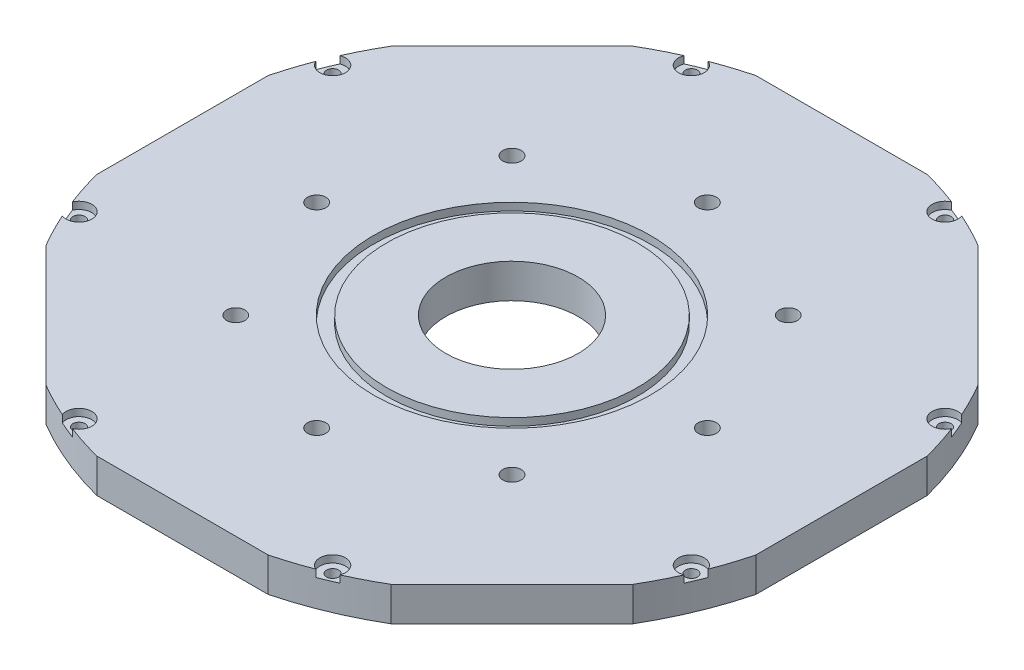
from build123d import *

# Parameters (mm, degrees)
BOSS_EXTRUDE1_DEPTH                                 = 12.7
SKETCH3_R                                           = 24.5745
CUT_EXTRUDE1_DEPTH                                  = 174.423960282
SKETCH5_R                                           = 51.3715
SKETCH5_R_2                                         = 46.5455
CUT_EXTRUDE2_DEPTH                                  = 2.794
CIRPATTERN4_COUNT                                   = 8
CBORE_FOR_8_BINDING_HEAD_MACHINE_SCREW2_D           = 4.4958
CBORE_FOR_8_BINDING_HEAD_MACHINE_SCREW2_CBORE_D     = 9.525
CBORE_FOR_8_BINDING_HEAD_MACHINE_SCREW2_CBORE_DEPTH = 2.667
CIRPATTERN5_COUNT                                   = 8


with BuildPart() as part:
    # Sketch1 → Boss-Extrude1 (new body)
    with BuildSketch(Plane(origin=(0, 0, 0), x_dir=(1, 0, 0), z_dir=(0, 1, 0))):
        with BuildLine():
            ThreePointArc((-31.793446259, 122.3), (-48.357791931, 116.746037126), (-63.997797892, 108.960520786))
            Line((-63.997797892, 108.960520786), (-108.960520786, 63.997797892))
            ThreePointArc((-108.960520786, 63.997797892), (-116.746037126, 48.357791931), (-122.3, 31.793446259))
            Line((-122.3, 31.793446259), (-122.3, -31.793446259))
            ThreePointArc((-122.3, -31.793446259), (-116.746037126, -48.357791931), (-108.960520786, -63.997797892))
            Line((-108.960520786, -63.997797892), (-63.997797892, -108.960520786))
            ThreePointArc((-63.997797892, -108.960520786), (-48.357791931, -116.746037126), (-31.793446259, -122.3))
            Line((-31.793446259, -122.3), (31.793446259, -122.3))
            ThreePointArc((31.793446259, -122.3), (48.357791931, -116.746037126), (63.997797892, -108.960520786))
            Line((63.997797892, -108.960520786), (108.960520786, -63.997797892))
            ThreePointArc((108.960520786, -63.997797892), (116.746037126, -48.357791931), (122.3, -31.793446259))
            Line((122.3, -31.793446259), (122.3, 31.793446259))
            ThreePointArc((122.3, 31.793446259), (116.746037126, 48.357791931), (108.960520786, 63.997797892))
            Line((108.960520786, 63.997797892), (63.997797892, 108.960520786))
            ThreePointArc((63.997797892, 108.960520786), (48.357791931, 116.746037126), (31.793446259, 122.3))
            Line((31.793446259, 122.3), (-31.793446259, 122.3))
        make_face()
    extrude(amount=BOSS_EXTRUDE1_DEPTH)

    # Sketch3 → Cut-Extrude1 (cut, through all)
    with BuildSketch(Plane(origin=(0, 12.7, 0), x_dir=(1, 0, 0), z_dir=(0, 1, 0))):
        with Locations(Location((0, 0, 0), (0, 0, 270))):
            Circle(SKETCH3_R)
    extrude(amount=-CUT_EXTRUDE1_DEPTH, mode=Mode.SUBTRACT)

    # Sketch5 → Cut-Extrude2 (cut)
    with BuildSketch(Plane(origin=(0, 12.7, 0), x_dir=(1, 0, 0), z_dir=(0, 1, 0))):
        with Locations(Location((0, 0, 0), (0, 0, 270))):
            Circle(SKETCH5_R)
        with Locations(Location((0, 0, 0), (0, 0, 270))):
            Circle(SKETCH5_R_2, mode=Mode.SUBTRACT)
    extrude(amount=-CUT_EXTRUDE2_DEPTH, mode=Mode.SUBTRACT)

    # Sketch23 → M8x1.25 Tapped Hole1 (revolve, cut)
    with BuildSketch(Plane(origin=(-72.5, 12.7, 0), x_dir=(0, 0, 1), z_dir=(1, 0, 0))):
        Polygon((0, 0), (0, 8.392926105), (3.4, 6.35), (3.4, 0), align=None)
    m8x1_25_tapped_hole1 = revolve(axis=Axis((-72.5, 19.05, 0), (0, -1, 0)), mode=Mode.SUBTRACT)

    # CirPattern4: M8x1.25 Tapped Hole1 ×8 about axis
    cirpattern4_axis = Axis((0, 0, 0), (0, 1, 0))
    for i in range(1, CIRPATTERN4_COUNT):
        add(m8x1_25_tapped_hole1.rotate(cirpattern4_axis, i * 360 / CIRPATTERN4_COUNT), mode=Mode.SUBTRACT)

    # CBORE for #8 Binding Head Machine Screw2 (through all)
    with Locations(Plane(origin=(0, 12.7, 0), x_dir=(1, 0, 0), z_dir=(0, 1, 0))):
        with Locations((-47.069870839, 113.636720559)):
            cbore_for_8_binding_head_machine_screw2 = CounterBoreHole(CBORE_FOR_8_BINDING_HEAD_MACHINE_SCREW2_D / 2, CBORE_FOR_8_BINDING_HEAD_MACHINE_SCREW2_CBORE_D / 2, CBORE_FOR_8_BINDING_HEAD_MACHINE_SCREW2_CBORE_DEPTH)

    # CirPattern5: CBORE for #8 Binding Head Machine Screw2 ×8 about axis
    cirpattern5_axis = Axis((0, 0, 0), (0, 1, 0))
    for i in range(1, CIRPATTERN5_COUNT):
        add(cbore_for_8_binding_head_machine_screw2.rotate(cirpattern5_axis, i * 360 / CIRPATTERN5_COUNT), mode=Mode.SUBTRACT)


solid = part.part
